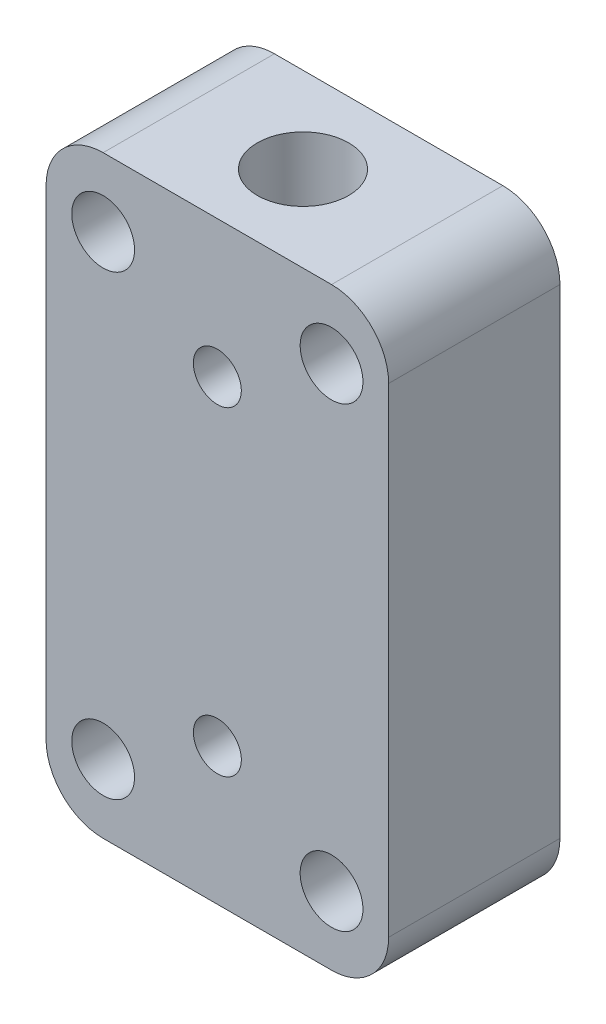
from build123d import *

# Parameters (mm, degrees)
ESQUISSE1_W                  = 30
ESQUISSE1_H                  = 52
BOSS_EXTRU_1_DEPTH           = 15
ENL_V_MAT_EXTRU_1_DEPTH      = 62.878914018
ENL_V_MAT_EXTRU_1_DEPTH_BACK = 62.878914018
ESQUISSE2_R                  = 4
ESQUISSE3_R                  = 2.75
ENL_V_MAT_EXTRU_2_DEPTH      = 62.878914018
CONG_1_R                     = 5
ESQUISSE4_R                  = 2.1
ENL_V_MAT_EXTRU_3_DEPTH      = 10


with BuildPart() as part:
    # Esquisse1 → Boss.-Extru.1 (new body)
    with BuildSketch(Plane.XY):
        with Locations((15, 26)):
            Rectangle(ESQUISSE1_W, ESQUISSE1_H)
    extrude(amount=BOSS_EXTRU_1_DEPTH)

    # Esquisse2 → Enlèv. mat.-Extru.1 (cut, two sides: drawn at the far end of the back side and taken through both)
    with BuildSketch(Plane(origin=(0, 52, 0), x_dir=(1, 0, 0), z_dir=(0, 1, 0)).offset(-ENL_V_MAT_EXTRU_1_DEPTH_BACK)):
        with Locations(Location((15, -7.5, 0), (0, 0, 270))):
            Circle(ESQUISSE2_R)
    extrude(amount=ENL_V_MAT_EXTRU_1_DEPTH + ENL_V_MAT_EXTRU_1_DEPTH_BACK, mode=Mode.SUBTRACT)

    # Esquisse3 → Enlèv. mat.-Extru.2 (cut, through all)
    with BuildSketch(Plane.XY.offset(15)):
        with Locations((5, 46)):
            Circle(ESQUISSE3_R)
        with Locations(Location((25, 46, 0), (0, 0, 180))):
            Circle(ESQUISSE3_R)
        with Locations((25, 6)):
            Circle(ESQUISSE3_R)
        with Locations(Location((5, 6, 0), (0, 0, 180))):
            Circle(ESQUISSE3_R)
    extrude(amount=-ENL_V_MAT_EXTRU_2_DEPTH, mode=Mode.SUBTRACT)

    # Congé1
    cong_1_edges = [part.edges().sort_by_distance(p)[0] for p in [
        (0, 52, 7.5),
        (30, 52, 7.5),
        (30, 0, 7.5),
        (0, 0, 7.5),
    ]]
    fillet(cong_1_edges, radius=CONG_1_R)

    # Esquisse4 → Enlèv. mat.-Extru.3 (cut)
    with BuildSketch(Plane.XY.offset(15)):
        with Locations((15, 40)):
            Circle(ESQUISSE4_R)
        with Locations(Location((15, 12, 0), (0, 0, 89.999999995))):
            Circle(ESQUISSE4_R)
    extrude(amount=-ENL_V_MAT_EXTRU_3_DEPTH, mode=Mode.SUBTRACT)


solid = part.part
